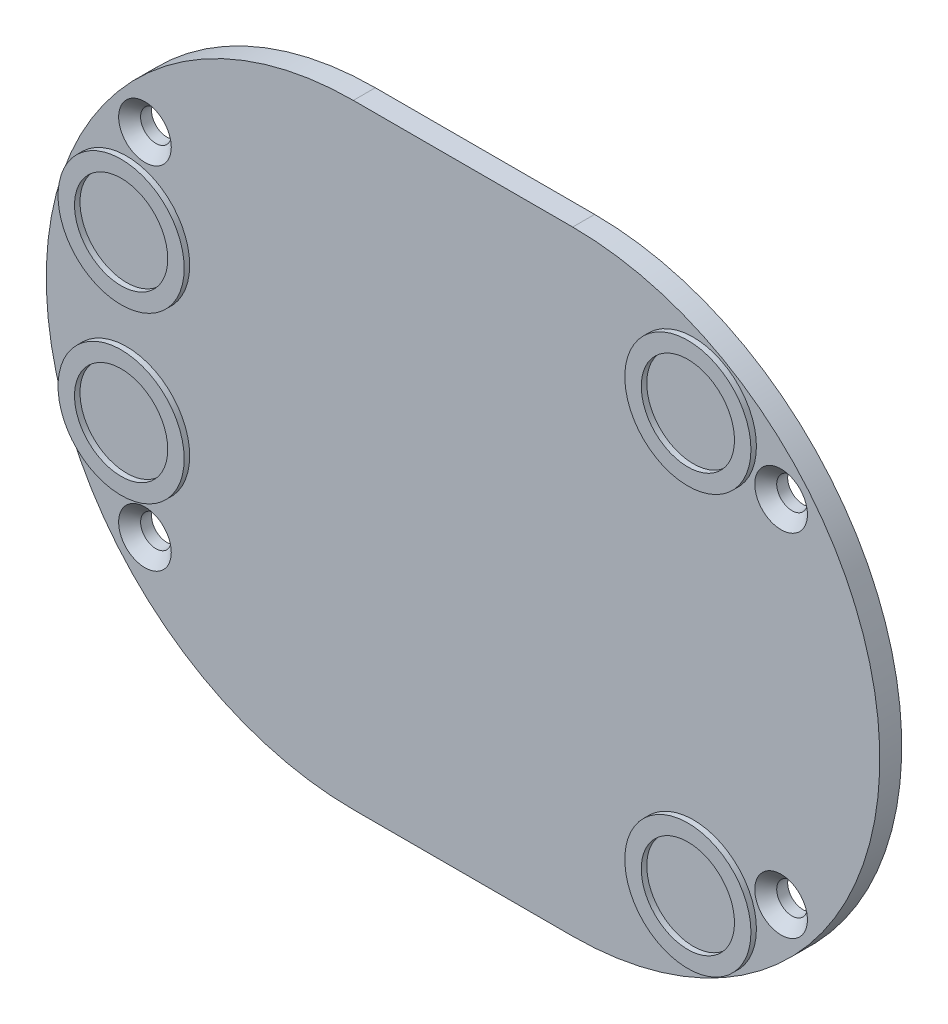
from build123d import *

# Parameters (mm, degrees)
EXTRUDE_2_DEPTH           = 2
HOLE_WIZARD_0_D           = 2.8
HOLE_WIZARD_0_DEPTH       = 10.1
HOLE_WIZARD_0_CSINK_D     = 4.8
HOLE_WIZARD_0_CSINK_ANGLE = 90
HOLE_WIZARD_0_TIP         = 0.841204867
SKETCH_7_R                = 5.75
SKETCH_7_R_2              = 4.25
EXTRUDE_1_DEPTH           = 0.5
EXTRUDE_2_2_DEPTH         = 21.5
CHAMFER_1_SIZE            = 1.5


with BuildPart() as part:
    # 草图3 → Extrude 2 (new body)
    with BuildSketch(Plane.XY):
        with BuildLine():
            Line((10, -28), (-10, -28))
            ThreePointArc((-10, -28), (-38, 0), (-10, 28))
            Line((-10, 28), (10, 28))
            ThreePointArc((10, 28), (38, 0), (10, -28))
        make_face()
    extrude(amount=EXTRUDE_2_DEPTH)

    # 打孔尺寸(%根据十字)槽沉头自攻螺钉的类型0
    with Locations(Plane.XY.offset(2)):
        with Locations((-29, 16), (-29, -16), (29, 16), (29, -16)):
            CounterSinkHole(HOLE_WIZARD_0_D / 2, HOLE_WIZARD_0_CSINK_D / 2, depth=HOLE_WIZARD_0_DEPTH, counter_sink_angle=HOLE_WIZARD_0_CSINK_ANGLE)
            with Locations((0, 0, -(HOLE_WIZARD_0_DEPTH + HOLE_WIZARD_0_TIP / 2))):  # 118° drill point
                Cone(0, HOLE_WIZARD_0_D / 2, HOLE_WIZARD_0_TIP, mode=Mode.SUBTRACT)

    # 草图7 → 拉伸-薄壁1 (add)
    # profile 1 of 4: a face of its own
    with BuildSketch(Plane.XY.offset(2)):
        with Locations((-30.673237657, 7.524443153)):
            Circle(SKETCH_7_R)
        with Locations((-30.673237657, 7.524443153)):
            Circle(SKETCH_7_R_2, mode=Mode.SUBTRACT)
    # profile 2 of 4: a face of its own
    with BuildSketch(Plane.XY.offset(2)):
        with Locations((-30.673237657, -7.524443153)):
            Circle(SKETCH_7_R)
        with Locations((-30.673237657, -7.524443153)):
            Circle(SKETCH_7_R_2, mode=Mode.SUBTRACT)
    # profile 3 of 4: a face of its own
    with BuildSketch(Plane.XY.offset(2)):
        with Locations((21, -19.052558883)):
            Circle(SKETCH_7_R)
        with Locations((21, -19.052558883)):
            Circle(SKETCH_7_R_2, mode=Mode.SUBTRACT)
    # profile 4 of 4: a face of its own
    with BuildSketch(Plane.XY.offset(2)):
        with Locations((21, 19.052558883)):
            Circle(SKETCH_7_R)
        with Locations((21, 19.052558883)):
            Circle(SKETCH_7_R_2, mode=Mode.SUBTRACT)
    extrude(amount=EXTRUDE_1_DEPTH)

    # 草图10 → Extrude 2 2 (add)
    with BuildSketch(Plane.XY.offset(2)):
        with BuildLine():
            ThreePointArc((-24.214911699, -8.37772555), (-17.550101998, -14.671263061), (-8.554999344, -16.436604671))
            Line((-8.554999344, -16.436604671), (-8.336059851, -18.926999318))
            ThreePointArc((-8.336059851, -18.926999318), (-18.694056847, -16.894181707), (-26.368686199, -9.647077906))
            Line((-26.368686199, -9.647077906), (-24.214911699, -8.37772555))
        make_face()
    extrude(amount=-EXTRUDE_2_2_DEPTH)

    # 倒角1
    chamfer_1_edges = [part.edges().sort_by_distance(p)[0] for p in [
        (-17.550101998, -14.671263061, 0),
        (-18.694056847, -16.894181707, 0),
    ]]
    chamfer(chamfer_1_edges, length=CHAMFER_1_SIZE)


solid = part.part
